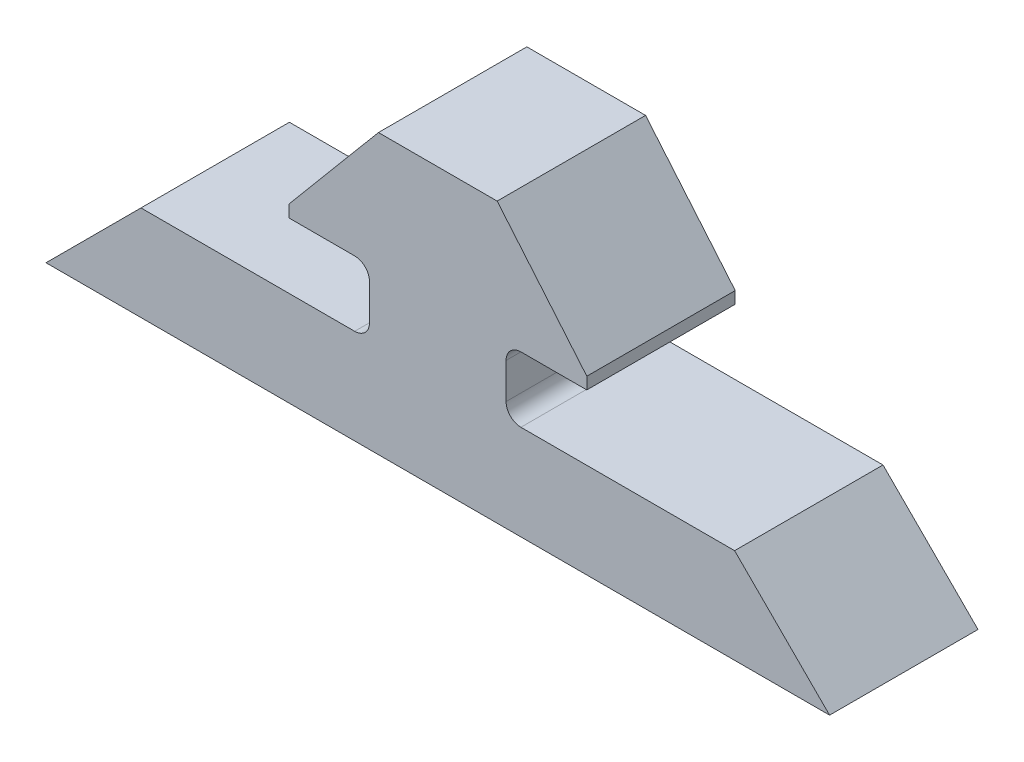
from build123d import *

# Parameters (mm, degrees)
BOSS_EXTRUDE8_DEPTH = 6.35


with BuildPart() as part:
    # Sketch1 → Boss-Extrude8 (new body)
    with BuildSketch(Plane(origin=(0, 0, -3683), x_dir=(-1, 0, 0), z_dir=(0, 0, -1))):
        with BuildLine():
            Line((12.7, 4.064), (3.556, 4.064))
            ThreePointArc((3.556, 4.064), (3.106987194, 4.249987194), (2.921, 4.699))
            Line((2.921, 4.699), (2.921, 6.223))
            ThreePointArc((2.921, 6.223), (3.106987194, 6.672012806), (3.556, 6.858))
            Line((3.556, 6.858), (6.376363549, 6.858))
            Line((6.376363549, 6.858), (6.376363549, 7.365999958))
            Line((6.376363549, 7.365999958), (2.54, 11.938))
            Line((2.54, 11.938), (-2.54, 11.938))
            Line((-2.54, 11.938), (-6.376363549, 7.365999958))
            Line((-6.376363549, 7.365999958), (-6.376363549, 6.858))
            Line((-6.376363549, 6.858), (-3.556, 6.858))
            ThreePointArc((-3.556, 6.858), (-3.106987194, 6.672012806), (-2.921, 6.223))
            Line((-2.921, 6.223), (-2.921, 4.699))
            ThreePointArc((-2.921, 4.699), (-3.106987194, 4.249987194), (-3.556, 4.064))
            Line((-3.556, 4.064), (-12.7, 4.064))
            Line((-12.7, 4.064), (-16.764, 0))
            Line((-16.764, 0), (-12.7, 0))
            Line((-12.7, 0), (12.7, 0))
            Line((12.7, 0), (16.764, 0))
            Line((16.764, 0), (12.7, 4.064))
        make_face()
    extrude(amount=BOSS_EXTRUDE8_DEPTH)


solid = part.part
